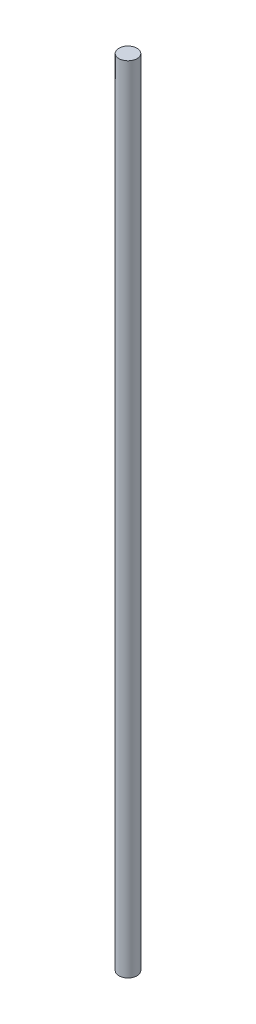
from build123d import *

# Parameters (mm, degrees)
SKETCH1_R           = 4
BOSS_EXTRUDE1_DEPTH = 351


with BuildPart() as part:
    # Sketch1 → Boss-Extrude1 (new body)
    with BuildSketch(Plane(origin=(0, 0, 0), x_dir=(1, 0, 0), z_dir=(0, 1, 0))):
        with Locations(Location((0, 0, 0), (0, 0, 270))):
            Circle(SKETCH1_R)
    extrude(amount=BOSS_EXTRUDE1_DEPTH)


solid = part.part
